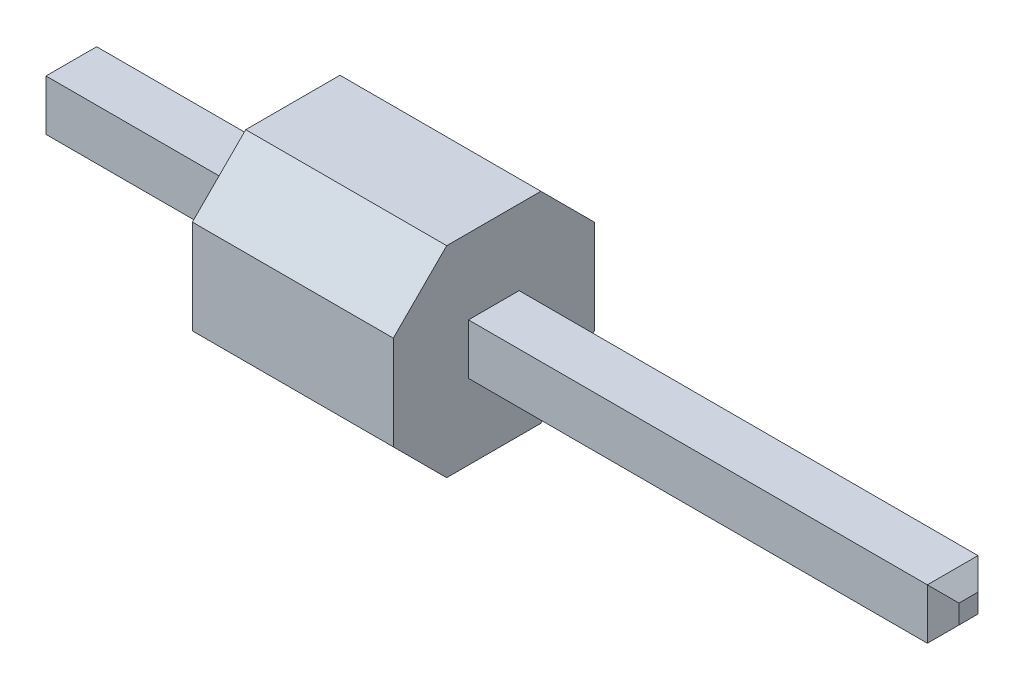
from build123d import *

# Parameters (mm, degrees)
CROQUIS1_W                   = 0.64
CROQUIS1_H                   = 0.64
SALIENTE_EXTRUIR1_DEPTH      = 2.54
CORTAR_EXTRUIR1_DEPTH        = 2.54
CORTAR_EXTRUIR1_DEPTH_BACK   = 2.54
SALIENTE_EXTRUIR2_DEPTH      = 8.54
SALIENTE_EXTRUIR2_DEPTH_BACK = 3
CROQUIS3_W                   = 0.64
CROQUIS3_H                   = 0.64
CHAFL_N1_SIZE                = 0.2


with BuildPart() as part:
    # Croquis1 → Saliente-Extruir1 (new body)
    with BuildSketch(Plane(origin=(0, 0, 0), x_dir=(0, 0, -1), z_dir=(1, 0, 0))):
        Polygon((-0.595482683, 1.27), (-1.27, 0.595482683), (-1.27, -0.595482683), (-0.595482683, -1.27), (0.595482683, -1.27), (1.27, -0.595482683), (1.27, 0.595482683), (0.595482683, 1.27), align=None)
        Rectangle(CROQUIS1_W, CROQUIS1_H, mode=Mode.SUBTRACT)
    extrude(amount=SALIENTE_EXTRUIR1_DEPTH)

    # Croquis2 → Cortar-Extruir1 (cut, two sides: drawn at the far end of the back side and taken through both)
    with BuildSketch(Plane(origin=(0, 0, 0), x_dir=(1, 0, 0), z_dir=(0, 1, 0)).offset(-CORTAR_EXTRUIR1_DEPTH_BACK)):
        with BuildLine():
            Line((0.516526244, 1.243275937), (0.516526244, 1.296724063))
            ThreePointArc((0.516526244, 1.296724063), (0.500491193, 1.351036929), (0.457528496, 1.387931603))
            Line((0.457528496, 1.387931603), (0, 1.593613049))
            Line((0, 1.593613049), (0, 0.946386951))
            Line((0, 0.946386951), (0.457528496, 1.152068397))
            ThreePointArc((0.457528496, 1.152068397), (0.500491193, 1.188963071), (0.516526244, 1.243275937))
        make_face()
    extrude(amount=CORTAR_EXTRUIR1_DEPTH + CORTAR_EXTRUIR1_DEPTH_BACK, mode=Mode.SUBTRACT)


with BuildPart() as body_2:
    # Croquis3 → Saliente-Extruir2 (new, two sides: drawn at the far end of the back side and taken through both)
    with BuildSketch(Plane(origin=(0, 0, 0), x_dir=(0, 0, -1), z_dir=(1, 0, 0)).offset(-SALIENTE_EXTRUIR2_DEPTH_BACK)):
        Rectangle(CROQUIS3_W, CROQUIS3_H)
    extrude(amount=SALIENTE_EXTRUIR2_DEPTH + SALIENTE_EXTRUIR2_DEPTH_BACK)

    # Chaflán1
    chafl_n1_edges = [body_2.edges().sort_by_distance(p)[0] for p in [
        (-3, 0, -0.32),
        (8.54, 0, 0.32),
        (8.54, -0.32, 0),
        (-3, 0.32, 0),
        (8.54, 0, -0.32),
        (8.54, 0.32, 0),
        (-3, 0, 0.32),
        (-3, -0.32, 0),
    ]]
    chamfer(chafl_n1_edges, length=CHAFL_N1_SIZE)


solid = Compound([part.part, body_2.part])
